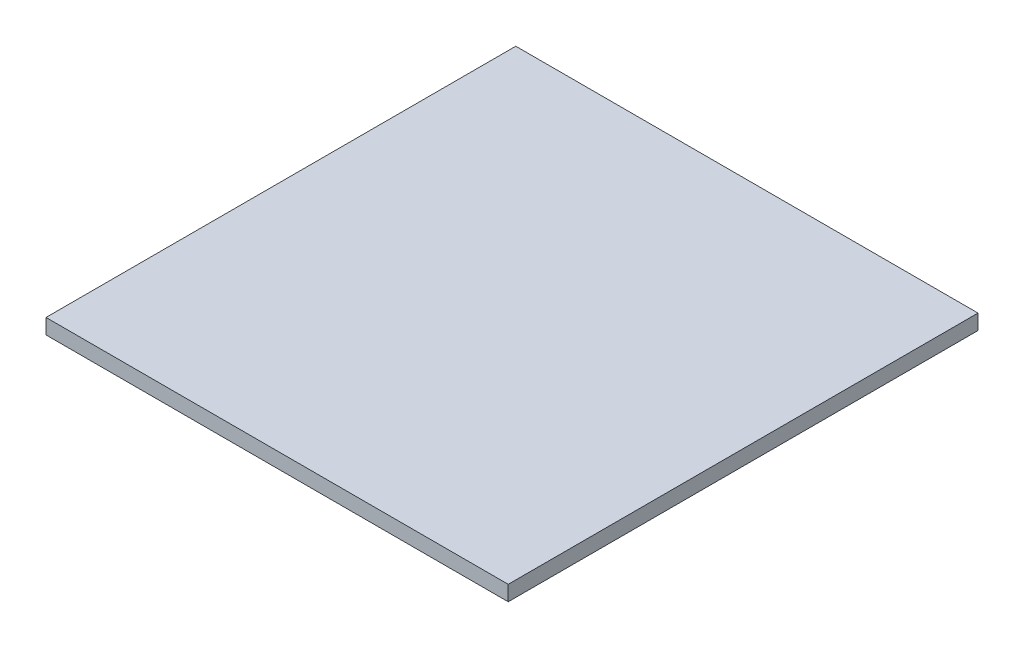
from build123d import *

# Parameters (mm, degrees)
SKETCH1_W           = 305
SKETCH1_H           = 310
BOSS_EXTRUDE1_DEPTH = 10


with BuildPart() as part:
    # Sketch1 → Boss-Extrude1 (new body)
    with BuildSketch(Plane(origin=(0, 0, 0), x_dir=(1, 0, 0), z_dir=(0, 1, 0))):
        Rectangle(SKETCH1_W, SKETCH1_H)
    extrude(amount=BOSS_EXTRUDE1_DEPTH)


solid = part.part
